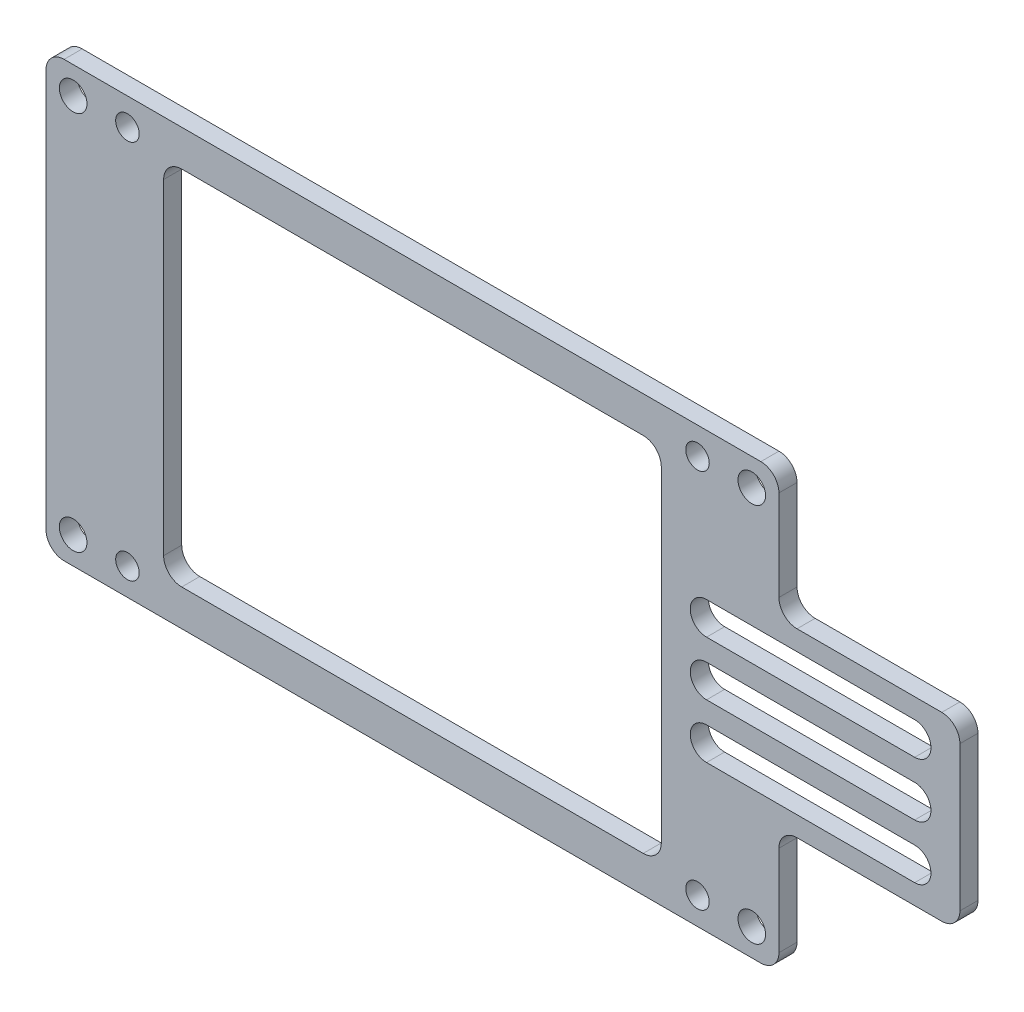
from build123d import *

# Parameters (mm, degrees)
SKETCH_1_W          = 81
SKETCH_1_H          = 48
SKETCH_1_R          = 1.3
EXTRUDE_1_DEPTH     = 1
SKETCH_2_R          = 1.525
CUT_EXTRUDE_1_DEPTH = 16
SKETCH_3_W          = 55
SKETCH_3_H          = 40
CUT_EXTRUDE_2_DEPTH = 21
FILLET_1_R          = 2
SKETCH_4_W          = 20
SKETCH_4_H          = 20
EXTRUDE_2_DEPTH     = 2
FILLET_2_R          = 2
CUT_EXTRUDE_3_DEPTH = 11


with BuildPart() as part:
    # 草图1 → 凸台-拉伸1 (new, symmetric)
    with BuildSketch(Plane.XY):
        Rectangle(SKETCH_1_W, SKETCH_1_H)
        with Locations((31.5, -21)):
            Circle(SKETCH_1_R, mode=Mode.SUBTRACT)
        with Locations((-31.5, -21)):
            Circle(SKETCH_1_R, mode=Mode.SUBTRACT)
        with Locations((-31.5, 21)):
            Circle(SKETCH_1_R, mode=Mode.SUBTRACT)
        with Locations((31.5, 21)):
            Circle(SKETCH_1_R, mode=Mode.SUBTRACT)
    extrude(amount=EXTRUDE_1_DEPTH, both=True)

    # 草图2 → 切除-拉伸1 (cut, symmetric)
    with BuildSketch(Plane.XY.offset(1)):
        with Locations(Location((37.5, 21, 0), (0, 0, 180))):
            Circle(SKETCH_2_R)
        with Locations(Location((37.5, -21, 0), (0, 0, 180))):
            Circle(SKETCH_2_R)
        with Locations(Location((-37.5, -21, 0), (0, 0, 180))):
            Circle(SKETCH_2_R)
        with Locations(Location((-37.5, 21, 0), (0, 0, 180))):
            Circle(SKETCH_2_R)
    extrude(amount=CUT_EXTRUDE_1_DEPTH, both=True, mode=Mode.SUBTRACT)

    # 草图3 → 切除-拉伸2 (cut, symmetric)
    with BuildSketch(Plane.XY.offset(1)):
        Rectangle(SKETCH_3_W, SKETCH_3_H)
    extrude(amount=CUT_EXTRUDE_2_DEPTH, both=True, mode=Mode.SUBTRACT)

    # 圆角1
    fillet_1_edges = [part.edges().sort_by_distance(p)[0] for p in [
        (27.5, 20, 0),
        (27.5, -20, 0),
        (-27.5, -20, 0),
        (-27.5, 20, 0),
        (40.5, -24, 0),
        (-40.5, -24, 0),
        (-40.5, 24, 0),
        (40.5, 24, 0),
    ]]
    fillet(fillet_1_edges, radius=FILLET_1_R)

    # 草图4 → 凸台-拉伸2 (add)
    with BuildSketch(Plane(origin=(0, 0, -1), x_dir=(-1, 0, 0), z_dir=(0, 0, -1))):
        with Locations((-50.5, 0)):
            Rectangle(SKETCH_4_W, SKETCH_4_H)
    extrude(amount=-EXTRUDE_2_DEPTH)

    # 圆角2
    fillet_2_edges = [part.edges().sort_by_distance(p)[0] for p in [
        (40.5, 10, 0),
        (40.5, -10, 0),
        (60.5, -10, 0),
        (60.5, 10, 0),
    ]]
    fillet(fillet_2_edges, radius=FILLET_2_R)

    # 草图5 → 切除-拉伸3 (cut, symmetric)
    with BuildSketch(Plane.XY.offset(1)):
        with BuildLine():
            Line((32.5, 1.8), (55.5, 1.8))
            ThreePointArc((55.5, 1.8), (57.3, 0), (55.5, -1.8))
            Line((55.5, -1.8), (32.5, -1.8))
            ThreePointArc((32.5, -1.8), (30.7, 0), (32.5, 1.8))
        make_face()
        with BuildLine():
            Line((32.5, 4.2), (55.5, 4.2))
            ThreePointArc((55.5, 4.2), (57.3, 6), (55.5, 7.8))
            Line((55.5, 7.8), (32.5, 7.8))
            ThreePointArc((32.5, 7.8), (30.7, 6), (32.5, 4.2))
        make_face()
        with BuildLine():
            Line((32.5, -4.2), (55.5, -4.2))
            ThreePointArc((55.5, -4.2), (57.3, -6), (55.5, -7.8))
            Line((55.5, -7.8), (32.5, -7.8))
            ThreePointArc((32.5, -7.8), (30.7, -6), (32.5, -4.2))
        make_face()
    extrude(amount=CUT_EXTRUDE_3_DEPTH, both=True, mode=Mode.SUBTRACT)


solid = part.part
